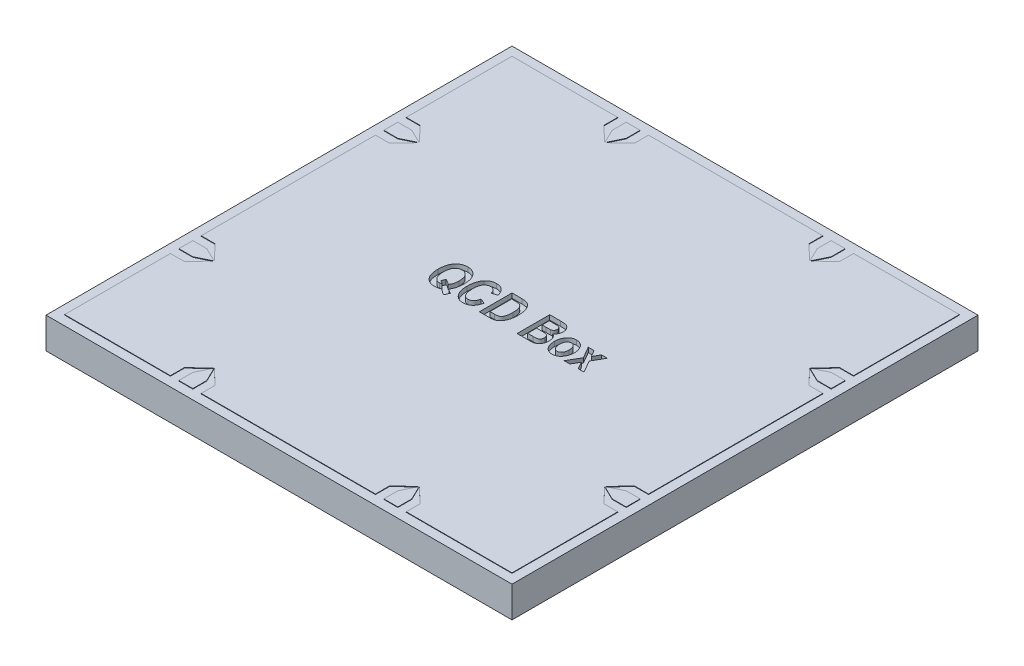
from build123d import *

# Parameters (mm, degrees)
SKETCH1_W           = 10
SKETCH1_H           = 10
BOSS_EXTRUDE1_DEPTH = 0.675
SKETCH2_W           = 10
SKETCH2_H           = 10
SKETCH2_W_2         = 9.6
SKETCH2_H_2         = 9.6
CUT_EXTRUDE1_DEPTH  = 0.01
CUT_EXTRUDE2_DEPTH  = 0.01
CUT_EXTRUDE3_DEPTH  = 0.1


with BuildPart() as part:
    # Sketch1 → Boss-Extrude1 (new body)
    with BuildSketch(Plane(origin=(0, 0, 0), x_dir=(1, 0, 0), z_dir=(0, 1, 0))):
        Rectangle(SKETCH1_W, SKETCH1_H)
    extrude(amount=BOSS_EXTRUDE1_DEPTH)

    # Sketch2 → Cut-Extrude1 (cut)
    with BuildSketch(Plane(origin=(0, 0.675, 0), x_dir=(1, 0, 0), z_dir=(0, 1, 0))):
        Rectangle(SKETCH2_W, SKETCH2_H)
        Rectangle(SKETCH2_W_2, SKETCH2_H_2, mode=Mode.SUBTRACT)
    extrude(amount=-CUT_EXTRUDE1_DEPTH, mode=Mode.SUBTRACT)

    # Sketch3 → Cut-Extrude2 (cut)
    with BuildSketch(Plane(origin=(0, 0.675, 0), x_dir=(1, 0, 0), z_dir=(0, 1, 0))):
        Polygon((-2.53, 4.8), (-2.35, 4.8), (-2.35, 4.5), (-2.205, 4.2), (-2.211, 4.2), (-2.53, 4.5), align=None)
        Polygon((-1.87, 4.8), (-1.87, 4.5), (-2.189, 4.2), (-2.195, 4.2), (-2.05, 4.5), (-2.05, 4.8), align=None)
        Polygon((2.05, 4.8), (1.87, 4.8), (1.87, 4.5), (2.189, 4.2), (2.195, 4.2), (2.05, 4.5), align=None)
        Polygon((2.211, 4.2), (2.205, 4.2), (2.35, 4.5), (2.35, 4.8), (2.53, 4.8), (2.53, 4.5), align=None)
        Polygon((4.8, 2.53), (4.8, 2.35), (4.5, 2.35), (4.2, 2.205), (4.2, 2.211), (4.5, 2.53), align=None)
        Polygon((4.8, 1.87), (4.5, 1.87), (4.2, 2.189), (4.2, 2.195), (4.5, 2.05), (4.8, 2.05), align=None)
        Polygon((4.8, -2.05), (4.8, -1.87), (4.5, -1.87), (4.2, -2.189), (4.2, -2.195), (4.5, -2.05), align=None)
        Polygon((4.2, -2.211), (4.2, -2.205), (4.5, -2.35), (4.8, -2.35), (4.8, -2.53), (4.5, -2.53), align=None)
        Polygon((2.53, -4.8), (2.35, -4.8), (2.35, -4.5), (2.205, -4.2), (2.211, -4.2), (2.53, -4.5), align=None)
        Polygon((1.87, -4.8), (1.87, -4.5), (2.189, -4.2), (2.195, -4.2), (2.05, -4.5), (2.05, -4.8), align=None)
        Polygon((-2.05, -4.8), (-1.87, -4.8), (-1.87, -4.5), (-2.189, -4.2), (-2.195, -4.2), (-2.05, -4.5), align=None)
        Polygon((-2.211, -4.2), (-2.205, -4.2), (-2.35, -4.5), (-2.35, -4.8), (-2.53, -4.8), (-2.53, -4.5), align=None)
        Polygon((-4.8, -2.53), (-4.8, -2.35), (-4.5, -2.35), (-4.2, -2.205), (-4.2, -2.211), (-4.5, -2.53), align=None)
        Polygon((-4.8, -1.87), (-4.5, -1.87), (-4.2, -2.189), (-4.2, -2.195), (-4.5, -2.05), (-4.8, -2.05), align=None)
        Polygon((-4.8, 2.05), (-4.8, 1.87), (-4.5, 1.87), (-4.2, 2.189), (-4.2, 2.195), (-4.5, 2.05), align=None)
        Polygon((-4.2, 2.211), (-4.2, 2.205), (-4.5, 2.35), (-4.8, 2.35), (-4.8, 2.53), (-4.5, 2.53), align=None)
    extrude(amount=-CUT_EXTRUDE2_DEPTH, mode=Mode.SUBTRACT)

    # Sketch5 → Cut-Extrude3 (cut)
    # profile 1 of 6: a face of its own
    with BuildSketch(Plane(origin=(0, 0.675, 0), x_dir=(1, 0, 0), z_dir=(0, 1, 0))):
        with BuildLine():
            add(Edge.make_bspline(
                [(-1.151854061, -0.205424308), (-1.144511553, -0.211417438), (-1.129901029, -0.223342897), (-1.106417617, -0.239020417), (-1.082173705, -0.253276319), (-1.065181684, -0.261147068), (-1.056683606, -0.265083399)],
                knots=[0, 0, 0, 0, 1.00866874, 2.00710438, 3.003309844, 4, 4, 4, 4], degree=3))
            Line((-1.056683606, -0.265083399), (-1.100291561, -0.361390217))
            add(Edge.make_bspline(
                [(-1.100291561, -0.361390217), (-1.109104934, -0.35800524), (-1.127069453, -0.351105557), (-1.143771935, -0.341544646), (-1.152280197, -0.336674308)],
                knots=[0, 0, 0, 0, 0.981197824, 2, 2, 2, 2], degree=3))
            add(Edge.make_bspline(
                [(-1.152280197, -0.336674308), (-1.153134255, -0.336108771), (-1.155576324, -0.334491693), (-1.160277815, -0.331194438), (-1.167082261, -0.326202559), (-1.176022665, -0.319514674), (-1.187090648, -0.311180204), (-1.200133397, -0.300985327), (-1.215525001, -0.289418491), (-1.226435694, -0.281050013), (-1.232251788, -0.276589081)],
                knots=[0, 0, 0, 0, 0.245733965, 0.702644866, 1.377434016, 2.270258751, 3.381183773, 4.701231263, 6.241546137, 8, 8, 8, 8], degree=3))
            add(Edge.make_bspline(
                [(-1.232251788, -0.276589081), (-1.237047958, -0.279028828), (-1.246634719, -0.283905486), (-1.26164274, -0.289931331), (-1.27701654, -0.295271648), (-1.292970779, -0.299524626), (-1.309496179, -0.302748589), (-1.326511195, -0.305179564), (-1.344015882, -0.30663438), (-1.355828608, -0.306774144), (-1.361797243, -0.306844762)],
                knots=[0, 0, 0, 0, 0.96057198, 1.920026713, 2.885388124, 3.865852884, 4.865850518, 5.890708888, 6.934235263, 8, 8, 8, 8], degree=3))
            add(Edge.make_bspline(
                [(-1.361797243, -0.306844762), (-1.371901502, -0.306604027), (-1.391689722, -0.306132569), (-1.420556404, -0.301486757), (-1.448025453, -0.294558755), (-1.473933901, -0.284262047), (-1.498516886, -0.271425038), (-1.521321871, -0.255248408), (-1.542823228, -0.236528544), (-1.562659041, -0.214923945), (-1.580672644, -0.190583569), (-1.596093108, -0.163371514), (-1.609401497, -0.133734327), (-1.61992285, -0.101403878), (-1.628340656, -0.066647368), (-1.634137154, -0.029300687), (-1.63798776, 0.010593398), (-1.638326957, 0.038079253), (-1.638501788, 0.052246147)],
                knots=[0, 0, 0, 0, 0.947648696, 1.855878837, 2.737616271, 3.60168255, 4.466468547, 5.334434689, 6.219492212, 7.137875445, 8.081848884, 9.055322791, 10.067899029, 11.126141109, 12.241766859, 13.421002704, 14.670720672, 16, 16, 16, 16], degree=3))
            add(Edge.make_bspline(
                [(-1.638501788, 0.052246147), (-1.638325417, 0.066412857), (-1.637982645, 0.09394552), (-1.634138319, 0.13393539), (-1.628341531, 0.171373613), (-1.619971946, 0.206213768), (-1.609204822, 0.238472873), (-1.596026592, 0.26816807), (-1.580329328, 0.295239838), (-1.562240655, 0.31957156), (-1.542242254, 0.341154422), (-1.520658495, 0.359913388), (-1.497634132, 0.375845508), (-1.473028836, 0.388855886), (-1.446890838, 0.398954678), (-1.419274334, 0.406240485), (-1.390153201, 0.410549875), (-1.370239793, 0.411071339), (-1.360092697, 0.411337056)],
                knots=[0, 0, 0, 0, 1.325551311, 2.576177175, 3.756481842, 4.868978776, 5.925657186, 6.935393612, 7.904517475, 8.848479123, 9.767294862, 10.653212949, 11.519856, 12.382216669, 13.252116938, 14.136792688, 15.05058218, 16, 16, 16, 16], degree=3))
            add(Edge.make_bspline(
                [(-1.360092697, 0.411337056), (-1.350039401, 0.411075796), (-1.330359563, 0.410564365), (-1.301531575, 0.406202064), (-1.274182477, 0.398981607), (-1.248283635, 0.388855609), (-1.223942763, 0.37580333), (-1.201083803, 0.359913932), (-1.179645148, 0.341148412), (-1.159791305, 0.319565004), (-1.14183116, 0.295238748), (-1.126344369, 0.26816036), (-1.113110841, 0.238622225), (-1.102278772, 0.20647802), (-1.094203514, 0.171722876), (-1.088286376, 0.134463558), (-1.084483107, 0.094654402), (-1.084135307, 0.067217262), (-1.083956334, 0.053098419)],
                knots=[0, 0, 0, 0, 0.945533866, 1.850930545, 2.735974148, 3.602169806, 4.4612212, 5.328779171, 6.216017803, 7.136664272, 8.082964012, 9.054975088, 10.065981232, 11.124021059, 12.241357431, 13.419100612, 14.671898348, 16, 16, 16, 16], degree=3))
            add(Edge.make_bspline(
                [(-1.083956334, 0.053098419), (-1.0841165, 0.039455008), (-1.084425061, 0.013171097), (-1.087633074, -0.024773579), (-1.092606317, -0.059770153), (-1.099778933, -0.092153932), (-1.1089921, -0.12254301), (-1.121003053, -0.151317709), (-1.134908511, -0.179208679), (-1.146193839, -0.196667656), (-1.151854061, -0.205424308)],
                knots=[0, 0, 0, 0, 1.205362501, 2.322120058, 3.362359562, 4.326735612, 5.250511105, 6.164254531, 7.079271134, 8, 8, 8, 8], degree=3))
        make_face()
        with BuildLine():
            add(Edge.make_bspline(
                [(-1.247450652, -0.124884535), (-1.24305346, -0.11958703), (-1.234144166, -0.108853581), (-1.223134407, -0.090645567), (-1.213922583, -0.070730981), (-1.206199305, -0.049163516), (-1.200300089, -0.02580054), (-1.196091128, -0.000719532), (-1.193495375, 0.026102487), (-1.193199711, 0.044569596), (-1.193047243, 0.054092738)],
                knots=[0, 0, 0, 0, 0.863345217, 1.749252022, 2.661353163, 3.614576314, 4.620864843, 5.682111508, 6.804708329, 8, 8, 8, 8], degree=3))
            add(Edge.make_bspline(
                [(-1.193047243, 0.054092738), (-1.193158485, 0.063946385), (-1.193373273, 0.082971794), (-1.195724312, 0.110526538), (-1.19933239, 0.136111359), (-1.204391731, 0.159725893), (-1.210894478, 0.181389189), (-1.218992606, 0.201034492), (-1.228467811, 0.21884442), (-1.239649412, 0.234511183), (-1.251890439, 0.248262124), (-1.264865835, 0.260402977), (-1.278851422, 0.270469772), (-1.293622355, 0.278867162), (-1.309302294, 0.285245155), (-1.325804614, 0.289759644), (-1.343079548, 0.292768745), (-1.354918734, 0.293024869), (-1.36094497, 0.293155238)],
                knots=[0, 0, 0, 0, 1.436691862, 2.773962903, 4.029794328, 5.202699272, 6.292689818, 7.323690881, 8.296929065, 9.22807889, 10.123225381, 10.978380823, 11.814021444, 12.630264847, 13.45093584, 14.275201199, 15.1220643, 16, 16, 16, 16], degree=3))
            add(Edge.make_bspline(
                [(-1.36094497, 0.293155238), (-1.366971729, 0.293026609), (-1.378811942, 0.292773906), (-1.396124523, 0.289732152), (-1.412654486, 0.28530212), (-1.428364808, 0.278814073), (-1.443125159, 0.270358194), (-1.45717383, 0.260218711), (-1.47028125, 0.248170061), (-1.482528184, 0.234367414), (-1.49368065, 0.218664264), (-1.503364391, 0.200938209), (-1.511399316, 0.181175804), (-1.518093295, 0.159512371), (-1.523098223, 0.135868577), (-1.526759536, 0.110293604), (-1.529071648, 0.082781056), (-1.529295499, 0.063756585), (-1.529410879, 0.053950692)],
                knots=[0, 0, 0, 0, 0.876848581, 1.722663039, 2.552553991, 3.365829814, 4.19045996, 5.025065834, 5.884242765, 6.778280825, 7.708277638, 8.683608006, 9.713332414, 10.810589915, 11.982042488, 13.229493461, 14.571981773, 16, 16, 16, 16], degree=3))
            add(Edge.make_bspline(
                [(-1.529410879, 0.053950692), (-1.529280383, 0.043956763), (-1.529028347, 0.02465484), (-1.526933957, -0.003344111), (-1.523218606, -0.029277246), (-1.518379385, -0.053305025), (-1.511828794, -0.075254972), (-1.503909429, -0.095259045), (-1.494535209, -0.113290725), (-1.483722744, -0.129282542), (-1.471710109, -0.143144137), (-1.45918049, -0.155411764), (-1.445806301, -0.165715861), (-1.431604184, -0.173944854), (-1.416848284, -0.180634213), (-1.401331968, -0.185309554), (-1.385047374, -0.188050284), (-1.373976265, -0.188456051), (-1.368331334, -0.188662944)],
                knots=[0, 0, 0, 0, 1.469371971, 2.83789331, 4.124714215, 5.319424688, 6.438363687, 7.488110163, 8.478364614, 9.42066665, 10.319263503, 11.171036346, 11.995366908, 12.794166486, 13.579503905, 14.372365502, 15.170102543, 16, 16, 16, 16], degree=3))
            add(Edge.make_bspline(
                [(-1.368331334, -0.188662944), (-1.36410827, -0.18857837), (-1.355661345, -0.188409205), (-1.343259847, -0.186286491), (-1.331091261, -0.183217163), (-1.323368149, -0.180134549), (-1.319467697, -0.178577717)],
                knots=[0, 0, 0, 0, 1.00771838, 2.015627189, 2.9978198, 4, 4, 4, 4], degree=3))
            add(Edge.make_bspline(
                [(-1.319467697, -0.178577717), (-1.325611999, -0.173902592), (-1.337558911, -0.164812329), (-1.356098952, -0.152818792), (-1.374391019, -0.14236735), (-1.38693981, -0.136722678), (-1.393047243, -0.133975444)],
                knots=[0, 0, 0, 0, 1.073447796, 2.087200056, 3.069049988, 4, 4, 4, 4], degree=3))
            Line((-1.393047243, -0.133975444), (-1.359666561, -0.052299308))
            add(Edge.make_bspline(
                [(-1.359666561, -0.052299308), (-1.349865198, -0.056657448), (-1.330031079, -0.065476617), (-1.30162749, -0.082396327), (-1.273699722, -0.101949624), (-1.256313372, -0.117140805), (-1.247450652, -0.124884535)],
                knots=[0, 0, 0, 0, 0.957793148, 1.938198301, 2.94899324, 4, 4, 4, 4], degree=3))
        make_face(mode=Mode.SUBTRACT)
    # profile 2 of 6: a face of its own
    with BuildSketch(Plane(origin=(0, 0.675, 0), x_dir=(1, 0, 0), z_dir=(0, 1, 0))):
        with BuildLine():
            Line((-0.62031997, -0.043208399), (-0.511229061, -0.088662944))
            add(Edge.make_bspline(
                [(-0.511229061, -0.088662944), (-0.513482099, -0.09783304), (-0.517872256, -0.115701425), (-0.526177827, -0.141240369), (-0.535317159, -0.164936619), (-0.545773068, -0.186657539), (-0.557187074, -0.206593694), (-0.569865714, -0.224548904), (-0.583570448, -0.240615101), (-0.598379228, -0.254754746), (-0.614268036, -0.26692078), (-0.630790755, -0.277761952), (-0.648374051, -0.286649403), (-0.66677171, -0.294153488), (-0.686128371, -0.299731529), (-0.706296967, -0.303929235), (-0.727364066, -0.306331358), (-0.741715604, -0.306671702), (-0.749013152, -0.306844762)],
                knots=[0, 0, 0, 0, 1.282586353, 2.499182829, 3.646034602, 4.730797578, 5.771318175, 6.763713287, 7.712684321, 8.6363956, 9.539720391, 10.428356747, 11.317388874, 12.212151588, 13.124116906, 14.050177375, 15.008543639, 16, 16, 16, 16], degree=3))
            add(Edge.make_bspline(
                [(-0.749013152, -0.306844762), (-0.758169352, -0.306638908), (-0.776106133, -0.306235645), (-0.802279343, -0.301896636), (-0.827185408, -0.295304268), (-0.850779431, -0.285837586), (-0.873089391, -0.27373715), (-0.893879603, -0.258748983), (-0.913635188, -0.241431068), (-0.925121699, -0.227928199), (-0.930973379, -0.221049308)],
                knots=[0, 0, 0, 0, 1.053414494, 2.063614103, 3.046293227, 4.01520277, 4.983805463, 5.961130836, 6.961320097, 8, 8, 8, 8], degree=3))
            add(Edge.make_bspline(
                [(-0.930973379, -0.221049308), (-0.937405551, -0.212556453), (-0.950363755, -0.195446812), (-0.966632061, -0.167233045), (-0.980468568, -0.136922094), (-0.991793066, -0.104486486), (-1.000619916, -0.069890287), (-1.00679103, -0.033117003), (-1.010496972, 0.00581558), (-1.010981331, 0.032493544), (-1.011229061, 0.046138192)],
                knots=[0, 0, 0, 0, 0.898140554, 1.809387162, 2.740718204, 3.705966939, 4.703925369, 5.74945803, 6.848943185, 8, 8, 8, 8], degree=3))
            add(Edge.make_bspline(
                [(-1.011229061, 0.046138192), (-1.011002742, 0.060542047), (-1.010561911, 0.088598339), (-1.006592895, 0.129445634), (-1.0005423, 0.167954911), (-0.991521114, 0.203983038), (-0.980220091, 0.237736891), (-0.96625771, 0.269005985), (-0.950045984, 0.298117348), (-0.936819069, 0.315503637), (-0.930263152, 0.324121147)],
                knots=[0, 0, 0, 0, 1.171098873, 2.281104103, 3.334483992, 4.338438261, 5.297974877, 6.225356982, 7.120398547, 8, 8, 8, 8], degree=3))
            add(Edge.make_bspline(
                [(-0.930263152, 0.324121147), (-0.924310702, 0.331087045), (-0.912579701, 0.344815336), (-0.89252863, 0.362592508), (-0.870987485, 0.377703738), (-0.847964059, 0.390075996), (-0.823355332, 0.399698735), (-0.797281745, 0.406488689), (-0.769638904, 0.410495035), (-0.750730985, 0.411052092), (-0.741058606, 0.411337056)],
                knots=[0, 0, 0, 0, 1.017460211, 2.005195831, 2.96880208, 3.936538458, 4.903086366, 5.898753713, 6.925103759, 8, 8, 8, 8], degree=3))
            add(Edge.make_bspline(
                [(-0.741058606, 0.411337056), (-0.733143072, 0.411147587), (-0.71758546, 0.410775195), (-0.694773043, 0.407798126), (-0.673038608, 0.402563365), (-0.652169994, 0.395696992), (-0.632350291, 0.386509856), (-0.613522192, 0.375361803), (-0.595611652, 0.362289484), (-0.584755791, 0.352126976), (-0.579268834, 0.346990465)],
                knots=[0, 0, 0, 0, 1.062174293, 2.087653736, 3.080296642, 4.058948008, 5.03139012, 6.005719887, 6.992016441, 8, 8, 8, 8], degree=3))
            add(Edge.make_bspline(
                [(-0.579268834, 0.346990465), (-0.575453805, 0.343031664), (-0.567679851, 0.33496474), (-0.557212204, 0.32137651), (-0.547520979, 0.306411708), (-0.538779929, 0.290006472), (-0.530653653, 0.272321144), (-0.523264291, 0.25326507), (-0.516763712, 0.232794898), (-0.513102446, 0.218600168), (-0.511229061, 0.211337056)],
                knots=[0, 0, 0, 0, 0.858002413, 1.748367619, 2.673305357, 3.63929672, 4.648357542, 5.711115493, 6.828831091, 8, 8, 8, 8], degree=3))
            Line((-0.511229061, 0.211337056), (-0.62031997, 0.174973419))
            add(Edge.make_bspline(
                [(-0.62031997, 0.174973419), (-0.621345091, 0.179629278), (-0.623339807, 0.188688805), (-0.62734469, 0.201762936), (-0.632220474, 0.213906206), (-0.637525391, 0.22541013), (-0.643913394, 0.235876806), (-0.650595447, 0.245806338), (-0.658430779, 0.254603519), (-0.666708591, 0.262730605), (-0.675720864, 0.269753755), (-0.684945735, 0.276105098), (-0.694658234, 0.281385775), (-0.704817847, 0.285632766), (-0.715304241, 0.289069866), (-0.726195558, 0.291486918), (-0.737466871, 0.292950604), (-0.745126108, 0.293086348), (-0.749013152, 0.293155238)],
                knots=[0, 0, 0, 0, 1.200071046, 2.335138942, 3.437621639, 4.493482591, 5.51985659, 6.521917265, 7.50210956, 8.480124453, 9.438987346, 10.374745328, 11.297656865, 12.216555725, 13.143999084, 14.072438006, 15.021767148, 16, 16, 16, 16], degree=3))
            add(Edge.make_bspline(
                [(-0.749013152, 0.293155238), (-0.754514283, 0.292992135), (-0.765341073, 0.292671133), (-0.781203252, 0.290117175), (-0.796211028, 0.285599934), (-0.810590349, 0.279669688), (-0.824099588, 0.271768833), (-0.836889135, 0.262200787), (-0.848615092, 0.250676397), (-0.859853185, 0.237713435), (-0.870036799, 0.222694214), (-0.878683383, 0.20533599), (-0.885815244, 0.185700729), (-0.891958502, 0.163929256), (-0.896554789, 0.139878529), (-0.899744471, 0.113585792), (-0.901735192, 0.085089174), (-0.902000743, 0.065317747), (-0.902138152, 0.055087056)],
                knots=[0, 0, 0, 0, 0.827686898, 1.628972485, 2.409099021, 3.181967192, 3.964173723, 4.757978677, 5.579415306, 6.433460257, 7.33665582, 8.302235029, 9.343905073, 10.476376866, 11.703364719, 13.024698166, 14.460435141, 16, 16, 16, 16], degree=3))
            add(Edge.make_bspline(
                [(-0.902138152, 0.055087056), (-0.901982887, 0.044479037), (-0.901683893, 0.024051205), (-0.899941, -0.005453432), (-0.896628175, -0.032561435), (-0.892387506, -0.057379395), (-0.886584549, -0.07976225), (-0.879495116, -0.099723707), (-0.871329217, -0.117458644), (-0.861588176, -0.132734374), (-0.850794908, -0.145921878), (-0.839319692, -0.157371504), (-0.826940983, -0.166936074), (-0.813989946, -0.175041991), (-0.800111022, -0.181184441), (-0.785468405, -0.185363626), (-0.770148934, -0.188254165), (-0.759633076, -0.18852486), (-0.754268834, -0.188662944)],
                knots=[0, 0, 0, 0, 1.588381619, 3.058741945, 4.422565575, 5.675514383, 6.825848758, 7.879737597, 8.8437938, 9.742560847, 10.584031071, 11.391113559, 12.163968987, 12.921455088, 13.673648094, 14.427376256, 15.197789283, 16, 16, 16, 16], degree=3))
            add(Edge.make_bspline(
                [(-0.754268834, -0.188662944), (-0.750334615, -0.188541099), (-0.742530227, -0.188299393), (-0.731046002, -0.186760276), (-0.719963918, -0.184008363), (-0.70928248, -0.180190397), (-0.699047211, -0.175153079), (-0.689153099, -0.169185319), (-0.679800016, -0.162012007), (-0.670745272, -0.153867063), (-0.662205014, -0.144498939), (-0.654399872, -0.133728235), (-0.647148012, -0.12174745), (-0.640493276, -0.108482283), (-0.634393222, -0.09401799), (-0.629014768, -0.078243576), (-0.624147766, -0.061237794), (-0.621620478, -0.049333954), (-0.62031997, -0.043208399)],
                knots=[0, 0, 0, 0, 0.874040642, 1.73385169, 2.568061146, 3.406503852, 4.248567505, 5.09821747, 5.96915136, 6.862782357, 7.800986125, 8.779254107, 9.812897901, 10.908933612, 12.073249979, 13.297367906, 14.609261928, 16, 16, 16, 16], degree=3))
        make_face()
    # profile 3 of 6: a face of its own
    with BuildSketch(Plane(origin=(0, 0.675, 0), x_dir=(1, 0, 0), z_dir=(0, 1, 0))):
        with BuildLine():
            Line((-0.402138152, 0.402246147), (-0.190348379, 0.402246147))
            add(Edge.make_bspline(
                [(-0.190348379, 0.402246147), (-0.183860789, 0.402194243), (-0.171305792, 0.402093798), (-0.153062991, 0.401248587), (-0.136063261, 0.399794028), (-0.120255119, 0.398063649), (-0.105745468, 0.395503268), (-0.092495664, 0.392324983), (-0.080360619, 0.388921206), (-0.065856506, 0.383106706), (-0.048784104, 0.374074496), (-0.029329307, 0.360523783), (-0.010953469, 0.343604057), (0.006689153, 0.323864752), (0.023052157, 0.300935685), (0.037561213, 0.274773768), (0.049955223, 0.245376955), (0.05887755, 0.218843024), (0.064812543, 0.195896253), (0.068778633, 0.177412284), (0.072179923, 0.157889395), (0.075023296, 0.137332841), (0.077156279, 0.115725009), (0.078456874, 0.09311855), (0.079580478, 0.069491929), (0.079646338, 0.053384023), (0.07968003, 0.045143874)],
                knots=[0, 0, 0, 0, 0.908166205, 1.757513041, 2.555659328, 3.296423069, 3.982950475, 4.616390098, 5.203654025, 5.745226596, 6.800700335, 7.90028988, 9.054632423, 10.289284126, 11.600705304, 12.989365954, 14.46805874, 16.061045217, 16.903458281, 17.784890152, 18.706788133, 19.676982865, 20.689369861, 21.745342977, 22.846609335, 24, 24, 24, 24], degree=3))
            add(Edge.make_bspline(
                [(0.07968003, 0.045143874), (0.079448095, 0.030504797), (0.078999131, 0.002167513), (0.075171104, -0.038909405), (0.068689301, -0.077039966), (0.059783904, -0.112127312), (0.048887232, -0.143918718), (0.036519184, -0.17231868), (0.023030435, -0.19744074), (0.007634703, -0.218998307), (-0.00919703, -0.237586905), (-0.027549345, -0.253649266), (-0.04750686, -0.267412813), (-0.069463219, -0.278626427), (-0.093799316, -0.287485045), (-0.121174359, -0.293377411), (-0.151657824, -0.297081037), (-0.173054357, -0.297522866), (-0.184240424, -0.297753853)],
                knots=[0, 0, 0, 0, 1.423656938, 2.755813916, 4.008096835, 5.182036843, 6.272883028, 7.273103345, 8.192341091, 9.040888725, 9.842934101, 10.626222939, 11.407993985, 12.194794984, 13.017916928, 13.919554796, 14.912347131, 16, 16, 16, 16], degree=3))
            Line((-0.184240424, -0.297753853), (-0.402138152, -0.297753853))
            Line((-0.402138152, -0.297753853), (-0.402138152, 0.402246147))
        make_face()
        with BuildLine():
            Line((-0.293047243, 0.284064329), (-0.293047243, -0.179572035))
            Line((-0.293047243, -0.179572035), (-0.199865424, -0.179572035))
            add(Edge.make_bspline(
                [(-0.199865424, -0.179572035), (-0.195034544, -0.179568754), (-0.185747861, -0.179562446), (-0.172308291, -0.178845157), (-0.159870401, -0.178353301), (-0.148527397, -0.176919613), (-0.138169236, -0.175609801), (-0.128880207, -0.173761323), (-0.1205751, -0.171644868), (-0.110981957, -0.168495904), (-0.100288459, -0.163366052), (-0.088547641, -0.156160827), (-0.078041981, -0.1475496), (-0.06863737, -0.137277438), (-0.060266535, -0.124698327), (-0.052764683, -0.109320007), (-0.046255764, -0.090878686), (-0.040243301, -0.069411016), (-0.03527352, -0.044551172), (-0.031874045, -0.016061811), (-0.029762633, 0.016039905), (-0.029532081, 0.038653485), (-0.029410879, 0.050541601)],
                knots=[0, 0, 0, 0, 0.858490732, 1.650326785, 2.392144379, 3.069685377, 3.68146636, 4.247606386, 4.751804594, 5.204247195, 6.040121741, 6.852838077, 7.648110604, 8.446361275, 9.319374262, 10.324322919, 11.479823707, 12.790802805, 14.284548749, 15.980882315, 17.887121902, 20, 20, 20, 20], degree=3))
            add(Edge.make_bspline(
                [(-0.029410879, 0.050541601), (-0.029423287, 0.056839531), (-0.029447548, 0.069154084), (-0.030065679, 0.087053646), (-0.030872009, 0.103965813), (-0.032116688, 0.119792445), (-0.033869531, 0.134656105), (-0.035802532, 0.148448058), (-0.038064162, 0.161255661), (-0.041588291, 0.176601), (-0.046827066, 0.194162466), (-0.055147605, 0.213109965), (-0.064900309, 0.229763905), (-0.076377569, 0.243998509), (-0.08930192, 0.255900901), (-0.103497391, 0.265709513), (-0.11912372, 0.273248982), (-0.130298203, 0.276281776), (-0.13594497, 0.277814329)],
                knots=[0, 0, 0, 0, 1.108457535, 2.167404399, 3.152090602, 4.088510939, 4.961000864, 5.786027902, 6.539647428, 7.24926465, 8.556831451, 9.758435817, 10.883283124, 11.944064911, 12.964396832, 13.965348377, 14.971835819, 16, 16, 16, 16], degree=3))
            add(Edge.make_bspline(
                [(-0.13594497, 0.277814329), (-0.138355307, 0.278313097), (-0.143671239, 0.279413116), (-0.152499269, 0.280612592), (-0.162818565, 0.281778714), (-0.174670535, 0.28255018), (-0.188020202, 0.283312049), (-0.202941864, 0.28366251), (-0.219371799, 0.283964165), (-0.230831143, 0.284030035), (-0.236797243, 0.284064329)],
                knots=[0, 0, 0, 0, 0.583558982, 1.287023661, 2.111612924, 3.046011902, 4.102984757, 5.282460342, 6.58516209, 8, 8, 8, 8], degree=3))
            Line((-0.236797243, 0.284064329), (-0.293047243, 0.284064329))
        make_face(mode=Mode.SUBTRACT)
    # profile 4 of 6: a face of its own
    with BuildSketch(Plane(origin=(0, 0.675, 0), x_dir=(1, 0, 0), z_dir=(0, 1, 0))):
        with BuildLine():
            Line((0.406952757, 0.402246147), (0.64218003, 0.402246147))
            add(Edge.make_bspline(
                [(0.64218003, 0.402246147), (0.649897979, 0.402176878), (0.664769065, 0.402043411), (0.686188662, 0.401443166), (0.70579551, 0.399974105), (0.723603691, 0.398125573), (0.739670698, 0.396015945), (0.753911625, 0.392943261), (0.766455444, 0.38968131), (0.780754983, 0.384327028), (0.796896177, 0.375729891), (0.814236825, 0.362054285), (0.83020121, 0.345383233), (0.844103454, 0.325642527), (0.855978922, 0.303756386), (0.864532644, 0.280026408), (0.869628837, 0.254783037), (0.870264427, 0.237497173), (0.870589121, 0.228666601)],
                knots=[0, 0, 0, 0, 1.124473672, 2.166656478, 3.121089245, 3.988001344, 4.77526076, 5.480116183, 6.109319004, 6.661554265, 7.701543192, 8.758483104, 9.865986798, 11.052779462, 12.265628083, 13.483214642, 14.714287386, 16, 16, 16, 16], degree=3))
            add(Edge.make_bspline(
                [(0.870589121, 0.228666601), (0.87029939, 0.220554872), (0.869729915, 0.204611039), (0.865737551, 0.181287835), (0.858842056, 0.159200923), (0.849374661, 0.13861673), (0.837821591, 0.119861651), (0.824361596, 0.103566454), (0.809453211, 0.089578172), (0.798086221, 0.082562621), (0.792464121, 0.079092738)],
                knots=[0, 0, 0, 0, 1.102195328, 2.166396157, 3.204342149, 4.237991037, 5.237902837, 6.188656202, 7.104111395, 8, 8, 8, 8], degree=3))
            add(Edge.make_bspline(
                [(0.792464121, 0.079092738), (0.799698885, 0.075732996), (0.81410171, 0.06904449), (0.83338162, 0.054725221), (0.849813734, 0.036860299), (0.863945258, 0.016195849), (0.875188377, -0.007363237), (0.883064287, -0.033564915), (0.88798934, -0.062104671), (0.888504908, -0.081965795), (0.888770939, -0.092214081)],
                knots=[0, 0, 0, 0, 0.914365049, 1.820299747, 2.735925076, 3.690630122, 4.685376883, 5.720815912, 6.823947219, 8, 8, 8, 8], degree=3))
            add(Edge.make_bspline(
                [(0.888770939, -0.092214081), (0.888661992, -0.098561889), (0.888448566, -0.110997153), (0.886767509, -0.129287971), (0.883689807, -0.146765537), (0.879860721, -0.163590582), (0.874465886, -0.179526659), (0.86829362, -0.194850219), (0.860705019, -0.209358901), (0.85206145, -0.22301689), (0.842814201, -0.235740827), (0.832898777, -0.247155346), (0.822764723, -0.257455518), (0.811978836, -0.266289526), (0.800910536, -0.274021009), (0.789379387, -0.280474415), (0.777337113, -0.285484902), (0.769051989, -0.287887277), (0.764907303, -0.289089081)],
                knots=[0, 0, 0, 0, 1.22020471, 2.390363083, 3.526102761, 4.629955915, 5.703561803, 6.756598922, 7.802848293, 8.845806378, 9.861642828, 10.823224211, 11.750015592, 12.6357154, 13.499202288, 14.342595175, 15.170872714, 16, 16, 16, 16], degree=3))
            add(Edge.make_bspline(
                [(0.764907303, -0.289089081), (0.761504128, -0.289784368), (0.753789994, -0.291360408), (0.740705809, -0.293164927), (0.724766329, -0.294434203), (0.705976438, -0.295815919), (0.684227373, -0.296509025), (0.659608899, -0.297279391), (0.63209601, -0.29767771), (0.61282404, -0.297727615), (0.602691394, -0.297753853)],
                knots=[0, 0, 0, 0, 0.512375785, 1.161426047, 1.946914314, 2.871141027, 3.940743941, 5.156722563, 6.50508681, 8, 8, 8, 8], degree=3))
            Line((0.602691394, -0.297753853), (0.406952757, -0.297753853))
            Line((0.406952757, -0.297753853), (0.406952757, 0.402246147))
        make_face()
        with BuildLine():
            Line((0.516043666, 0.284064329), (0.516043666, 0.129518874))
            Line((0.516043666, 0.129518874), (0.599566394, 0.129518874))
            add(Edge.make_bspline(
                [(0.599566394, 0.129518874), (0.605532397, 0.129502842), (0.616896422, 0.129472304), (0.63304149, 0.129676858), (0.647390307, 0.129739639), (0.659887955, 0.130091009), (0.670594196, 0.1302908), (0.679490818, 0.130779258), (0.686654015, 0.131104682), (0.690808429, 0.13158413), (0.692606166, 0.131791601)],
                knots=[0, 0, 0, 0, 1.537921726, 2.929428249, 4.162267198, 5.236648627, 6.152403654, 6.922235861, 7.533619789, 8, 8, 8, 8], degree=3))
            add(Edge.make_bspline(
                [(0.692606166, 0.131791601), (0.697755019, 0.132732529), (0.707624687, 0.134536163), (0.721423709, 0.139536833), (0.733315944, 0.146573956), (0.743573023, 0.155332116), (0.75152662, 0.166166288), (0.757537964, 0.178642853), (0.760908225, 0.192981607), (0.761295839, 0.203081154), (0.761498212, 0.208354101)],
                knots=[0, 0, 0, 0, 1.100193615, 2.108925541, 3.069258182, 3.994366649, 4.926956476, 5.876216083, 6.891177988, 8, 8, 8, 8], degree=3))
            add(Edge.make_bspline(
                [(0.761498212, 0.208354101), (0.761302407, 0.213102137), (0.760928845, 0.222160599), (0.758235017, 0.235108776), (0.753534993, 0.246637316), (0.746923747, 0.256593578), (0.739100517, 0.264988457), (0.730398789, 0.27177493), (0.720807093, 0.276720014), (0.711859708, 0.279388499), (0.703205127, 0.280877311), (0.694218629, 0.281554578), (0.682820949, 0.28252955), (0.668883382, 0.282920715), (0.65246055, 0.283622772), (0.633561749, 0.283748361), (0.612209918, 0.284158873), (0.597151914, 0.28409701), (0.589197076, 0.284064329)],
                knots=[0, 0, 0, 0, 1.052351386, 2.007711197, 2.916182618, 3.795496935, 4.642249233, 5.450649971, 6.230038409, 7.020378978, 7.510527392, 8.174883014, 9.017067762, 10.046711282, 11.265182827, 12.661551488, 14.236365296, 16, 16, 16, 16], degree=3))
            Line((0.589197076, 0.284064329), (0.516043666, 0.284064329))
        make_face(mode=Mode.SUBTRACT)
        with BuildLine():
            Line((0.516043666, 0.011337056), (0.516043666, -0.179572035))
            Line((0.516043666, -0.179572035), (0.631384576, -0.179572035))
            add(Edge.make_bspline(
                [(0.631384576, -0.179572035), (0.63744518, -0.179532759), (0.648998857, -0.179457885), (0.665432974, -0.179226194), (0.680161735, -0.178655313), (0.693193662, -0.177857725), (0.704552346, -0.17667923), (0.714200302, -0.175523706), (0.722106431, -0.173920791), (0.730457242, -0.171774827), (0.739406882, -0.16759908), (0.749009536, -0.161020242), (0.757686891, -0.152524513), (0.765422315, -0.14238957), (0.771927912, -0.1305203), (0.776343478, -0.116984645), (0.779336294, -0.10205125), (0.779562299, -0.091567407), (0.77968003, -0.086106126)],
                knots=[0, 0, 0, 0, 1.422074328, 2.710981391, 3.856134465, 4.880390511, 5.773592636, 6.5356346, 7.158764273, 7.665440749, 8.555459036, 9.45835037, 10.38545437, 11.392024878, 12.440928025, 13.544085548, 14.72065637, 16, 16, 16, 16], degree=3))
            add(Edge.make_bspline(
                [(0.77968003, -0.086106126), (0.779488415, -0.080508101), (0.779120349, -0.069755051), (0.776342395, -0.054337945), (0.771312284, -0.040546738), (0.764444449, -0.028304093), (0.755902696, -0.017828479), (0.746078137, -0.008932276), (0.734877926, -0.001920387), (0.724355039, 0.002401156), (0.71465573, 0.00506466), (0.705604084, 0.00661332), (0.694921235, 0.008282649), (0.682526821, 0.009247192), (0.668475142, 0.010362108), (0.65269213, 0.010776911), (0.635223022, 0.011284192), (0.623004459, 0.011318898), (0.616611848, 0.011337056)],
                knots=[0, 0, 0, 0, 1.220775758, 2.344945564, 3.400211975, 4.408337778, 5.392209119, 6.335627291, 7.286926182, 8.259293687, 8.805475582, 9.477947255, 10.260788822, 11.163063353, 12.188028698, 13.335114355, 14.605762531, 16, 16, 16, 16], degree=3))
            Line((0.616611848, 0.011337056), (0.516043666, 0.011337056))
        make_face(mode=Mode.SUBTRACT)
    # profile 5 of 6: a face of its own
    with BuildSketch(Plane(origin=(0, 0.675, 0), x_dir=(1, 0, 0), z_dir=(0, 1, 0))):
        with BuildLine():
            add(Edge.make_bspline(
                [(0.952407303, -0.036106126), (0.952746114, -0.024009454), (0.95341281, -0.000206207), (0.959145538, 0.034561903), (0.968160592, 0.067748386), (0.979041837, 0.093821096), (0.989243479, 0.113514786), (0.997475608, 0.127335743), (1.006337455, 0.140165867), (1.015628934, 0.152075377), (1.025588539, 0.163003884), (1.035973193, 0.17303607), (1.04705466, 0.182094031), (1.062482743, 0.192792424), (1.083004611, 0.203980424), (1.109279956, 0.213550829), (1.137040465, 0.219456894), (1.156071012, 0.220100368), (1.165759576, 0.220427965)],
                knots=[0, 0, 0, 0, 1.556681502, 3.063162581, 4.524556931, 5.976049118, 6.690484325, 7.379521108, 8.045822696, 8.697116328, 9.322943537, 9.94817653, 10.554730816, 11.163578782, 12.36395075, 13.552075371, 14.75374718, 16, 16, 16, 16], degree=3))
            add(Edge.make_bspline(
                [(1.165759576, 0.220427965), (1.1738678, 0.220165649), (1.189737686, 0.219652229), (1.212890666, 0.21612674), (1.234659638, 0.209941197), (1.255164852, 0.201459422), (1.274132246, 0.190178102), (1.291957231, 0.176797363), (1.308187225, 0.160676872), (1.322931417, 0.142426065), (1.336191679, 0.122594491), (1.347857339, 0.101749168), (1.357632188, 0.080045987), (1.365913918, 0.057655029), (1.371854502, 0.034238138), (1.376473042, 0.010111601), (1.379234235, -0.014877076), (1.379530032, -0.031790631), (1.37968003, -0.04036749)],
                knots=[0, 0, 0, 0, 1.032054068, 2.019995973, 2.972061934, 3.906723031, 4.836005299, 5.773828533, 6.737027708, 7.73951492, 8.755857002, 9.770356733, 10.776442903, 11.783124641, 12.804973846, 13.847568463, 14.908502576, 16, 16, 16, 16], degree=3))
            add(Edge.make_bspline(
                [(1.37968003, -0.04036749), (1.379613841, -0.046762663), (1.379482765, -0.059427266), (1.377961676, -0.078193423), (1.375776546, -0.096511123), (1.372458455, -0.114384743), (1.368246949, -0.131745574), (1.3630378, -0.148644673), (1.357176788, -0.165116023), (1.350155175, -0.180943263), (1.342596351, -0.196139653), (1.334143534, -0.21027905), (1.325403147, -0.223639324), (1.315777618, -0.235787522), (1.305896782, -0.247286746), (1.295196844, -0.257629846), (1.283961373, -0.267054428), (1.268342216, -0.278123723), (1.247813217, -0.289599082), (1.221698758, -0.299532979), (1.19441034, -0.305726582), (1.175734922, -0.306470192), (1.166327757, -0.306844762)],
                knots=[0, 0, 0, 0, 1.007877983, 1.995938637, 2.966162127, 3.914814336, 4.859789072, 5.780608151, 6.70142723, 7.613889557, 8.508470822, 9.375089484, 10.209347433, 11.023051667, 11.81647726, 12.597661281, 13.366010139, 14.126084987, 15.612979557, 17.05878539, 18.518454158, 20, 20, 20, 20], degree=3))
            add(Edge.make_bspline(
                [(1.166327757, -0.306844762), (1.158787907, -0.30662121), (1.143967308, -0.306181787), (1.122231624, -0.302868775), (1.101523717, -0.297298724), (1.081791956, -0.289595529), (1.063020383, -0.279688827), (1.045184824, -0.267612405), (1.028546462, -0.253039937), (1.012774583, -0.236690979), (0.99850259, -0.2181579), (0.986207055, -0.19760672), (0.975558937, -0.175296016), (0.967146106, -0.15101299), (0.960428953, -0.124940078), (0.955851826, -0.096937896), (0.952970424, -0.067132463), (0.952598207, -0.046624405), (0.952407303, -0.036106126)],
                knots=[0, 0, 0, 0, 0.932512926, 1.832980627, 2.712496059, 3.580506363, 4.447765331, 5.333190401, 6.238540988, 7.178967574, 8.139661075, 9.125124005, 10.136480502, 11.192447616, 12.299149515, 13.463368684, 14.698999463, 16, 16, 16, 16], degree=3))
        make_face()
        with BuildLine():
            add(Edge.make_bspline(
                [(1.061498212, -0.043208399), (1.061548356, -0.049367702), (1.061645736, -0.061329178), (1.063301955, -0.078684239), (1.065696642, -0.094902214), (1.068814606, -0.110023893), (1.073358129, -0.123882045), (1.078484126, -0.136706496), (1.084797486, -0.148321896), (1.092021772, -0.158685559), (1.100026126, -0.167784935), (1.10842834, -0.175722973), (1.117061746, -0.18273992), (1.126405213, -0.188056362), (1.135993325, -0.192411658), (1.14595252, -0.195537521), (1.156355897, -0.197480944), (1.163430824, -0.197661696), (1.167037985, -0.197753853)],
                knots=[0, 0, 0, 0, 1.413435947, 2.744917549, 3.997764295, 5.176762478, 6.28365779, 7.341374166, 8.343333232, 9.311285103, 10.235656245, 11.119850599, 11.963565454, 12.781974458, 13.579916342, 14.377487969, 15.172760151, 16, 16, 16, 16], degree=3))
            add(Edge.make_bspline(
                [(1.167037985, -0.197753853), (1.170550335, -0.197659303), (1.177483672, -0.197472663), (1.187699822, -0.195536021), (1.197474648, -0.192427108), (1.206877235, -0.188086708), (1.215865615, -0.182475836), (1.224509361, -0.17568628), (1.232666031, -0.167567035), (1.240460348, -0.158414873), (1.247596015, -0.147970478), (1.253885555, -0.136342549), (1.258864125, -0.123384501), (1.263401862, -0.10949933), (1.266537683, -0.09428816), (1.268970608, -0.077980968), (1.27039069, -0.06046834), (1.270521668, -0.04841925), (1.270589121, -0.042214081)],
                knots=[0, 0, 0, 0, 0.808000523, 1.59498332, 2.384605109, 3.165141781, 3.972995168, 4.819296264, 5.690514241, 6.61887202, 7.583588115, 8.598212565, 9.655073588, 10.775752316, 11.958364484, 13.22583637, 14.571331316, 16, 16, 16, 16], degree=3))
            add(Edge.make_bspline(
                [(1.270589121, -0.042214081), (1.270538965, -0.0361494), (1.270441602, -0.024376811), (1.268787648, -0.007305374), (1.266380595, 0.008675248), (1.263259648, 0.023602899), (1.258775295, 0.037365177), (1.253392025, 0.050003276), (1.247167407, 0.06163123), (1.239879633, 0.071997347), (1.231963187, 0.081164457), (1.223660507, 0.089222462), (1.214998282, 0.096106935), (1.20587594, 0.10167019), (1.196373565, 0.105980721), (1.186521676, 0.109144325), (1.176202936, 0.111051499), (1.169176681, 0.111241043), (1.16561753, 0.111337056)],
                knots=[0, 0, 0, 0, 1.402767332, 2.723012804, 3.964152086, 5.141819357, 6.247084086, 7.307339051, 8.317264307, 9.29291199, 10.232905452, 11.116215361, 11.966638267, 12.787762059, 13.582061217, 14.375528767, 15.177123852, 16, 16, 16, 16], degree=3))
            add(Edge.make_bspline(
                [(1.16561753, 0.111337056), (1.162105391, 0.111242028), (1.155172471, 0.111054443), (1.14495325, 0.109124749), (1.135148965, 0.105976413), (1.125666163, 0.101709664), (1.116643193, 0.096060672), (1.10800492, 0.089222257), (1.099688585, 0.081210625), (1.091952316, 0.071938084), (1.084552705, 0.061655271), (1.07864702, 0.049836627), (1.073067823, 0.037226247), (1.068941037, 0.023260182), (1.065450794, 0.008289747), (1.063364647, -0.007940515), (1.061631484, -0.025179067), (1.0615434, -0.037095344), (1.061498212, -0.043208399)],
                knots=[0, 0, 0, 0, 0.81048791, 1.599893392, 2.39194599, 3.184828714, 3.995169034, 4.844075423, 5.725810169, 6.657025848, 7.630933707, 8.643556476, 9.70192074, 10.812346547, 12.000966443, 13.249126104, 14.58880056, 16, 16, 16, 16], degree=3))
        make_face(mode=Mode.SUBTRACT)
    # profile 6 of 6: a face of its own
    with BuildSketch(Plane(origin=(0, 0.675, 0), x_dir=(1, 0, 0), z_dir=(0, 1, 0))):
        Polygon((1.416043666, -0.297753853), (1.567606166, -0.035395899), (1.425134576, 0.211337056), (1.549282303, 0.211337056), (1.62968003, 0.07213251), (1.710077757, 0.211337056), (1.834225485, 0.211337056), (1.691753894, -0.035395899), (1.843316394, -0.297753853), (1.719026621, -0.297753853), (1.62968003, -0.142924308), (1.540191394, -0.297753853), align=None)
    extrude(amount=-CUT_EXTRUDE3_DEPTH, mode=Mode.SUBTRACT)


solid = part.part
